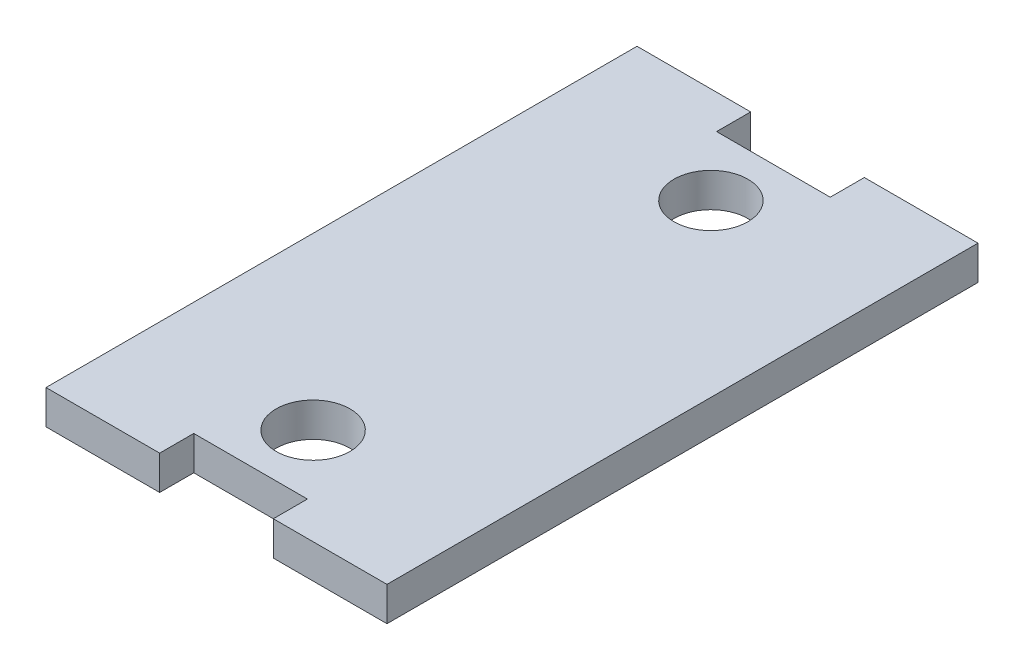
from build123d import *

# Parameters (mm, degrees)
SKETCH1_R           = 1.625
BOSS_EXTRUDE1_DEPTH = 1.5


with BuildPart() as part:
    # Sketch1 → Boss-Extrude1 (new body)
    with BuildSketch(Plane(origin=(0, 0, 0), x_dir=(1, 0, 0), z_dir=(0, 1, 0))):
        Polygon((-7.5, 13), (-2.5, 13), (-2.5, 11.5), (2.5, 11.5), (2.5, 13), (7.5, 13), (7.5, -13), (2.5, -13), (2.5, -11.5), (-2.5, -11.5), (-2.5, -13), (-7.5, -13), align=None)
        with Locations(Location((0, 8.75, 0), (0, 0, 270))):
            Circle(SKETCH1_R, mode=Mode.SUBTRACT)
        with Locations(Location((0, -8.75, 0), (0, 0, 90))):
            Circle(SKETCH1_R, mode=Mode.SUBTRACT)
    extrude(amount=BOSS_EXTRUDE1_DEPTH)


solid = part.part
